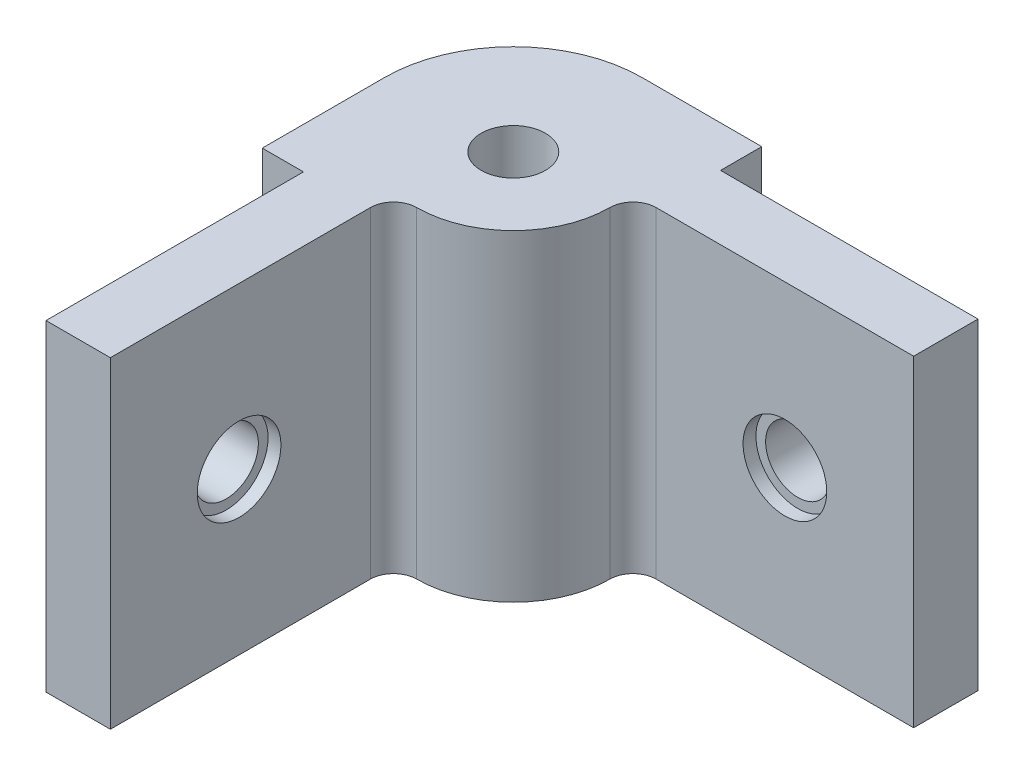
from build123d import *

# Parameters (mm, degrees)
SKETCH4_R               = 2.5
BOSS_EXTRUDE1_DEPTH     = 25
SKETCH5_R               = 2.5
CUT_EXTRUDE1_DEPTH      = 55.976783394
CUT_EXTRUDE3_DEPTH      = 46.809522816
CUT_EXTRUDE3_DEPTH_BACK = 46.809522816
SKETCH7_R               = 2.5
SKETCH8_R               = 3.25
CUT_EXTRUDE4_DEPTH      = 1
SKETCH6_R               = 3.25
CUT_EXTRUDE2_DEPTH      = 1


with BuildPart() as part:
    # Sketch4 → Boss-Extrude1 (new body)
    with BuildSketch(Plane(origin=(0, 0, 0), x_dir=(1, 0, 0), z_dir=(0, 1, 0))):
        with BuildLine():
            Line((12.859651739, 14.301163983), (32.859651739, 14.301163983))
            Line((32.859651739, 14.301163983), (32.859651739, 19.301163983))
            Line((32.859651739, 19.301163983), (12.859651739, 19.301163983))
            Line((12.859651739, 19.301163983), (12.859651739, 22.501163983))
            Line((12.859651739, 22.501163983), (3.559651739, 22.501163983))
            ThreePointArc((3.559651739, 22.501163983), (-3.511416073, 19.572231795), (-6.440348261, 12.501163983))
            Line((-6.440348261, 12.501163983), (-6.440348261, 3.001163983))
            Line((-6.440348261, 3.001163983), (-3.240348261, 3.001163983))
            Line((-3.240348261, 3.001163983), (-3.240348261, -16.998836017))
            Line((-3.240348261, -16.998836017), (1.759651739, -16.998836017))
            Line((1.759651739, -16.998836017), (1.759651739, 3.201163983))
            ThreePointArc((1.759651739, 3.201163983), (2.286859533, 4.473956189), (3.559651739, 5.001163983))
            ThreePointArc((3.559651739, 5.001163983), (8.862952598, 7.197863124), (11.059651739, 12.501163983))
            ThreePointArc((11.059651739, 12.501163983), (11.586859533, 13.773956189), (12.859651739, 14.301163983))
        make_face()
        with Locations(Location((3.559651739, 12.501163983, 0), (0, 0, 270))):
            Circle(SKETCH4_R, mode=Mode.SUBTRACT)
    extrude(amount=BOSS_EXTRUDE1_DEPTH)

    # Sketch5 → Cut-Extrude1 (cut, through all)
    with BuildSketch(Plane(origin=(0, 0, -19.301163983), x_dir=(-1, 0, 0), z_dir=(0, 0, -1))):
        with Locations((-22.859651739, 12.5)):
            Circle(SKETCH5_R)
    extrude(amount=-CUT_EXTRUDE1_DEPTH, mode=Mode.SUBTRACT)

    # Sketch7 → Cut-Extrude3 (cut, two sides: drawn at the far end of the back side and taken through both)
    with BuildSketch(Plane(origin=(1.759651739, 0, 0), x_dir=(0, 0, -1), z_dir=(1, 0, 0)).offset(-CUT_EXTRUDE3_DEPTH_BACK)):
        with Locations((-6.998836017, 12.5)):
            Circle(SKETCH7_R)
    extrude(amount=CUT_EXTRUDE3_DEPTH + CUT_EXTRUDE3_DEPTH_BACK, mode=Mode.SUBTRACT)

    # Sketch8 → Cut-Extrude4 (cut)
    with BuildSketch(Plane(origin=(1.759651739, 0, 0), x_dir=(0, 0, -1), z_dir=(1, 0, 0))):
        with Locations((-6.998836017, 12.5)):
            Circle(SKETCH8_R)
    extrude(amount=-CUT_EXTRUDE4_DEPTH, mode=Mode.SUBTRACT)

    # Sketch6 → Cut-Extrude2 (cut)
    with BuildSketch(Plane.XY.offset(-14.301163983)):
        with Locations((22.859651739, 12.5)):
            Circle(SKETCH6_R)
    extrude(amount=-CUT_EXTRUDE2_DEPTH, mode=Mode.SUBTRACT)


solid = part.part
